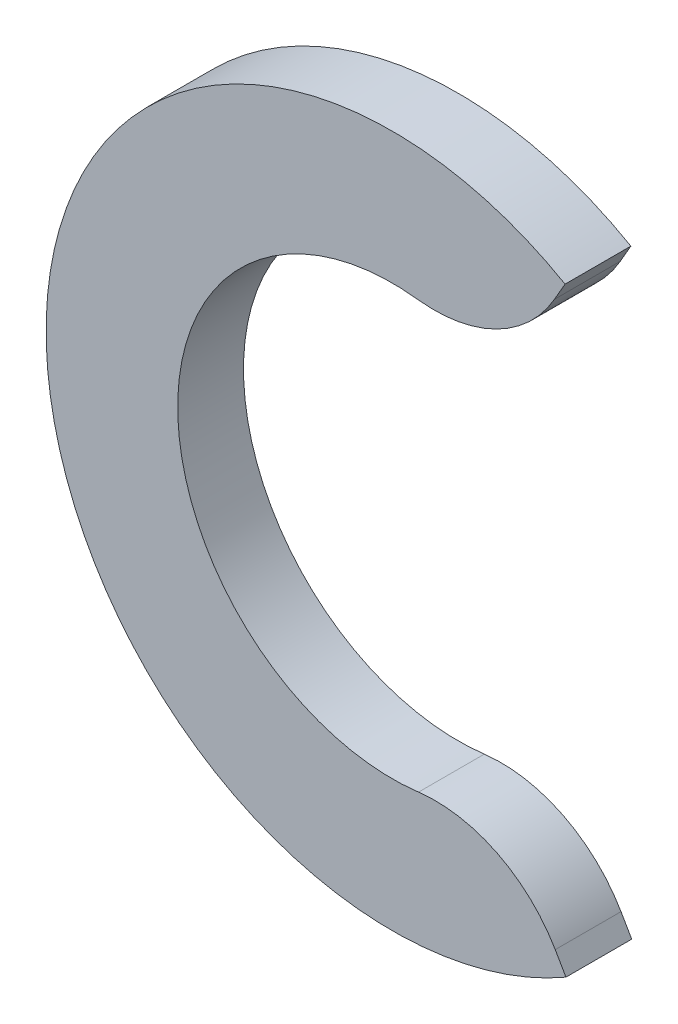
from build123d import *

# Parameters (mm, degrees)
BOSS_EXTRUDE1_DEPTH = 0.95
FILLET1_R           = 2


with BuildPart() as part:
    # Sketch1 → Boss-Extrude1 (new body)
    with BuildSketch(Plane.XY):
        with BuildLine():
            Line((1.546099973, 2.686926659), (2.493709634, 4.333752676))
            ThreePointArc((2.493709634, 4.333752676), (-4.999994729, -0.007260445), (2.506285094, -4.326492231))
            Line((2.506285094, -4.326492231), (1.553896759, -2.682425183))
            ThreePointArc((1.553896759, -2.682425183), (-3.099996732, -0.004501476), (1.546099973, 2.686926659))
        make_face()
    extrude(amount=BOSS_EXTRUDE1_DEPTH)

    # Fillet1
    fillet1_edges = [part.edges().sort_by_distance(p)[0] for p in [
        (1.546099973, 2.686926659, 0.475),
        (1.553896759, -2.682425183, 0.475),
    ]]
    fillet(fillet1_edges, radius=FILLET1_R)


solid = part.part
